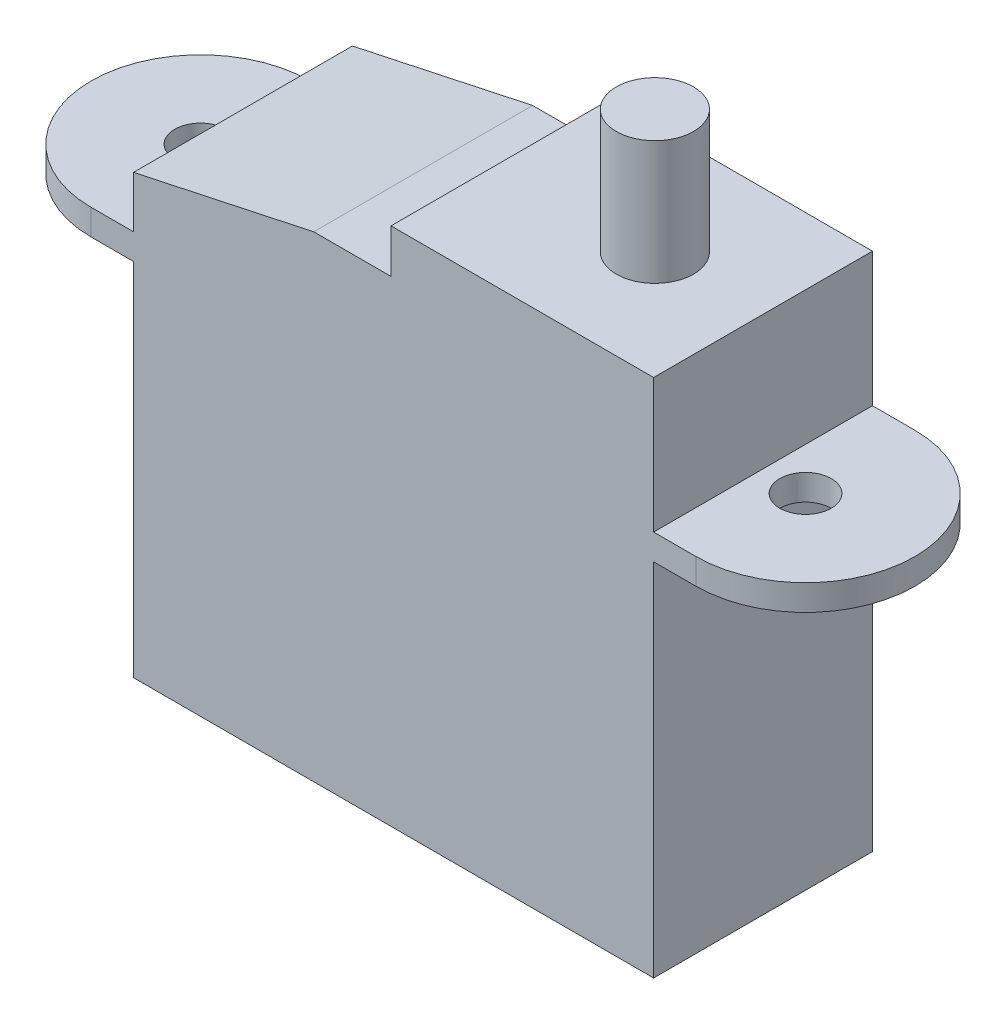
from build123d import *

# Parameters (mm, degrees)
SKETCH1_W           = 20.2
SKETCH1_H           = 8.5
BOSS_EXTRUDE1_DEPTH = 14
BOSS_EXTRUDE2_DEPTH = 1
SKETCH3_W           = 20.2
SKETCH3_H           = 8.5
BOSS_EXTRUDE3_DEPTH = 5.2
CUT_EXTRUDE1_DEPTH  = 20.2
SKETCH5_R           = 1
CUT_EXTRUDE2_DEPTH  = 32.280345267
SKETCH6_R           = 1.5
BOSS_EXTRUDE4_DEPTH = 4.8


with BuildPart() as part:
    # Sketch1 → Boss-Extrude1 (new body)
    with BuildSketch(Plane(origin=(0, 0, 0), x_dir=(1, 0, 0), z_dir=(0, 1, 0))):
        with Locations((10.1, 4.25)):
            Rectangle(SKETCH1_W, SKETCH1_H)
    extrude(amount=BOSS_EXTRUDE1_DEPTH)

    # Sketch2 → Boss-Extrude2 (add)
    with BuildSketch(Plane(origin=(0, 14, 0), x_dir=(1, 0, 0), z_dir=(0, 1, 0))):
        with BuildLine():
            Line((-1.65, 8.5), (21.85, 8.5))
            ThreePointArc((21.85, 8.5), (26.1, 4.25), (21.85, 0))
            Line((21.85, 0), (-1.65, 0))
            ThreePointArc((-1.65, 0), (-5.9, 4.25), (-1.65, 8.5))
        make_face()
    extrude(amount=BOSS_EXTRUDE2_DEPTH)

    # Sketch3 → Boss-Extrude3 (add)
    with BuildSketch(Plane(origin=(0, 15, 0), x_dir=(1, 0, 0), z_dir=(0, 1, 0))):
        with Locations((10.1, 4.25)):
            Rectangle(SKETCH3_W, SKETCH3_H)
    extrude(amount=BOSS_EXTRUDE3_DEPTH)

    # Sketch4 → Cut-Extrude1 (cut)
    with BuildSketch(Plane.XY):
        Polygon((0, 17), (7, 18.5), (10, 18.5), (10, 20.2), (20.2, 20.2), (20.2, 17.6), (23.419390589, 17.6), (23.419390589, 23.763762674), (-0.815558956, 23.763762674), align=None)
    extrude(amount=-CUT_EXTRUDE1_DEPTH, mode=Mode.SUBTRACT)

    # Sketch5 → Cut-Extrude2 (cut, through all)
    with BuildSketch(Plane(origin=(0, 15, 0), x_dir=(1, 0, 0), z_dir=(0, 1, 0))):
        with Locations(Location((-1.65, 4.25, 0), (0, 0, 270))):
            Circle(SKETCH5_R)
        with Locations(Location((21.85, 4.25, 0), (0, 0, 270))):
            Circle(SKETCH5_R)
    extrude(amount=-CUT_EXTRUDE2_DEPTH, mode=Mode.SUBTRACT)

    # Sketch6 → Boss-Extrude4 (add)
    with BuildSketch(Plane(origin=(0, 20.2, 0), x_dir=(1, 0, 0), z_dir=(0, 1, 0))):
        with Locations(Location((16, 4.25, 0), (0, 0, 90))):
            Circle(SKETCH6_R)
    extrude(amount=BOSS_EXTRUDE4_DEPTH)


solid = part.part
